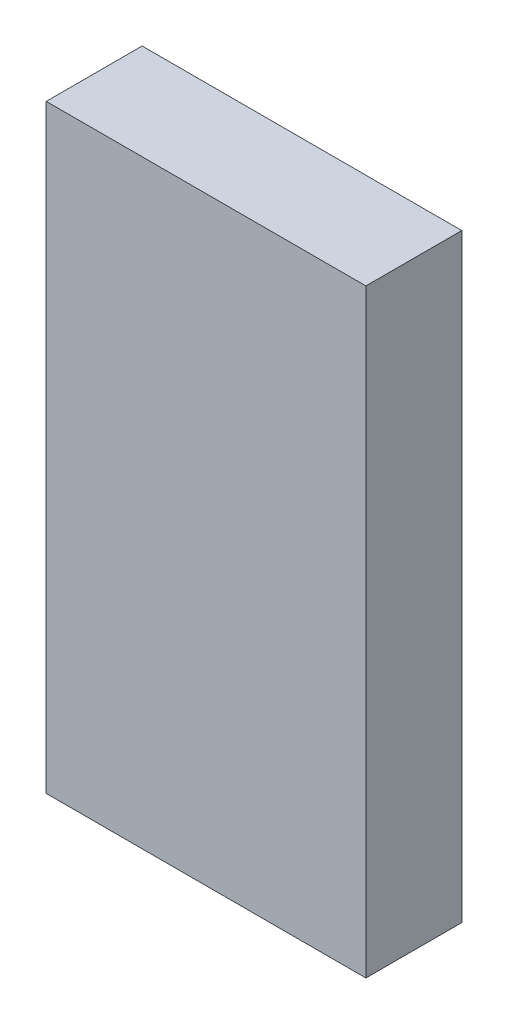
from build123d import *

# Parameters (mm, degrees)
SKETCH1_W           = 40
SKETCH1_H           = 12
BOSS_EXTRUDE1_DEPTH = 37.5
F_25_SCALE_SCALE    = 0.25


with BuildPart() as part:
    # Sketch1 → Boss-Extrude1 (new, symmetric)
    with BuildSketch(Plane(origin=(0, 0, 0), x_dir=(1, 0, 0), z_dir=(0, 1, 0))):
        Rectangle(SKETCH1_W, SKETCH1_H)
    extrude(amount=BOSS_EXTRUDE1_DEPTH, both=True)


with BuildPart() as part_1:
    # 25% Scale: scaled about (0, 0, 0)
    add(part.part.scale(F_25_SCALE_SCALE))


solid = part_1.part
